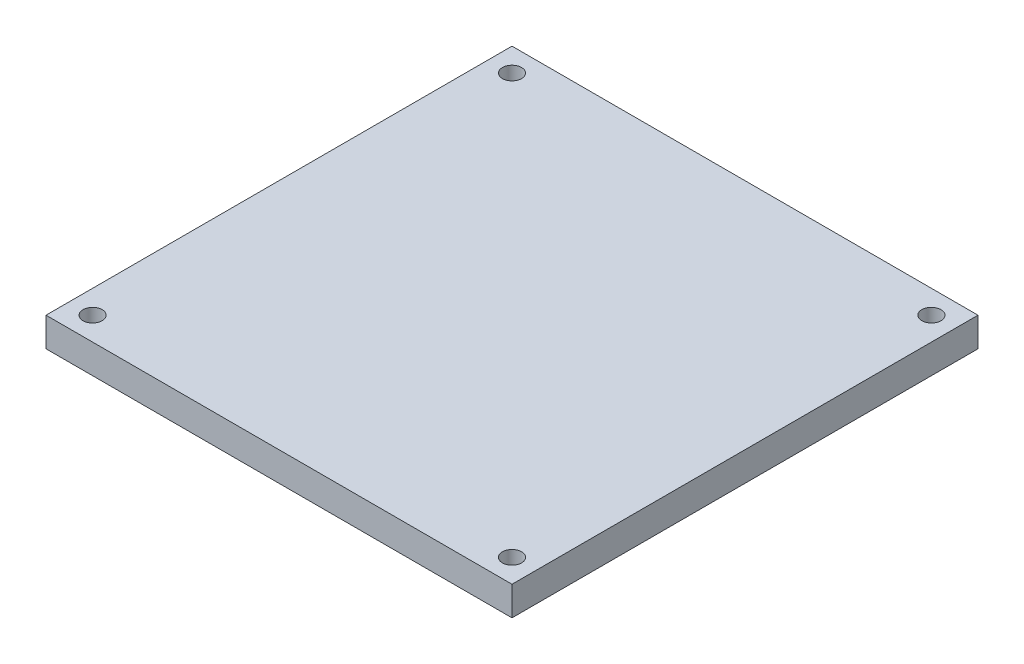
from build123d import *

# Parameters (mm, degrees)
ESQUISSE1_W      = 80
ESQUISSE1_H      = 80
ESQUISSE1_R      = 1.65
EXTRUSION1_DEPTH = 5


with BuildPart() as part:
    # Esquisse1 → Extrusion1 (new body)
    with BuildSketch(Plane(origin=(0, 0, 0), x_dir=(1, 0, 0), z_dir=(0, 1, 0))):
        Rectangle(ESQUISSE1_W, ESQUISSE1_H)
        with Locations(Location((-36, 36, 0), (0, 0, 270))):
            Circle(ESQUISSE1_R, mode=Mode.SUBTRACT)
        with Locations(Location((36, 36, 0), (0, 0, 90))):
            Circle(ESQUISSE1_R, mode=Mode.SUBTRACT)
        with Locations(Location((-36, -36, 0), (0, 0, 90))):
            Circle(ESQUISSE1_R, mode=Mode.SUBTRACT)
        with Locations(Location((36, -36, 0), (0, 0, 270))):
            Circle(ESQUISSE1_R, mode=Mode.SUBTRACT)
    extrude(amount=EXTRUSION1_DEPTH)


solid = part.part
